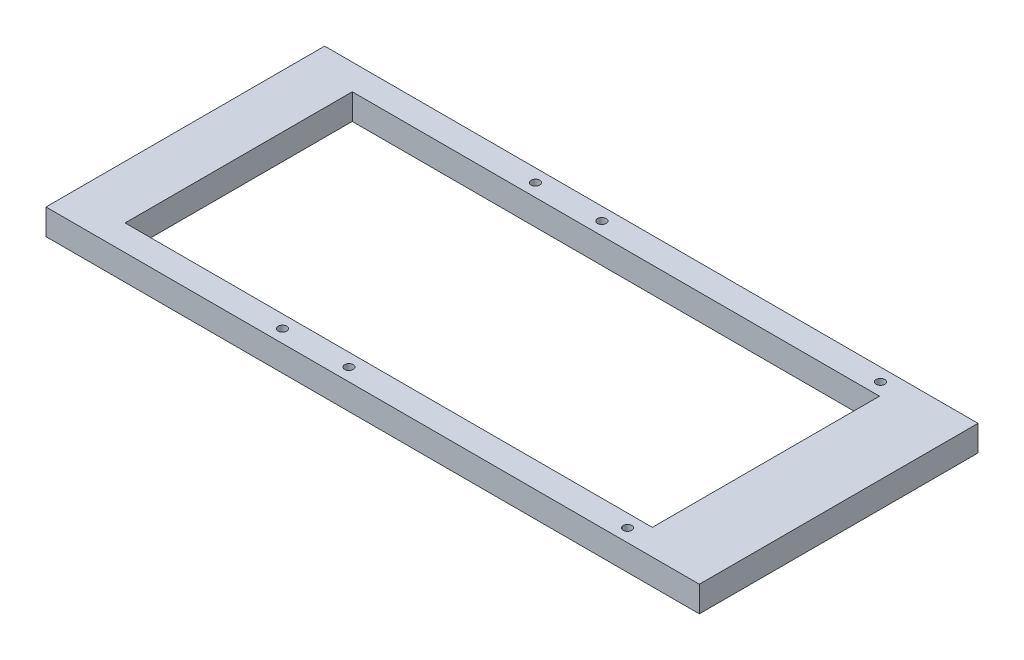
from build123d import *

# Parameters (mm, degrees)
SKETCH1_W                 = 246
SKETCH1_H                 = 106
BOSS_EXTRUDE1_DEPTH       = 12
SKETCH3_R                 = 2
CUT_EXTRUDE1_DEPTH        = 50.25
LPATTERN1_COUNT           = 2
LPATTERN1_PITCH           = 31
LPATTERN1_COPY_1_SKETCH_R = 2
LPATTERN1_COPY_1_DEPTH    = 50.25
LPATTERN2_COUNT           = 2
LPATTERN2_PITCH           = 161
MIRROR2_COPY_1_SKETCH_R   = 2
MIRROR2_COPY_1_DEPTH      = 50.25
MIRROR2_COPY_2_SKETCH_R   = 2
MIRROR2_COPY_2_DEPTH      = 50.25


with BuildPart() as part:
    # Sketch1 → Boss-Extrude1 (new body)
    with BuildSketch(Plane(origin=(0, 0, 0), x_dir=(1, 0, 0), z_dir=(0, 1, 0))):
        Polygon((-135, 65), (135, 65), (135, -65), (-135, -65), (-169.840376894, -65), (-169.840376894, 65), align=None)
        with Locations((-21.947414212, 0)):
            Rectangle(SKETCH1_W, SKETCH1_H, mode=Mode.SUBTRACT)
    extrude(amount=BOSS_EXTRUDE1_DEPTH)

    # Sketch3 → Cut-Extrude1 (cut)
    with BuildSketch(Plane(origin=(0, 12, 0), x_dir=(1, 0, 0), z_dir=(0, 1, 0))):
        with Locations(Location((-65.5, -59, 0), (0, 0, 270))):
            Circle(SKETCH3_R)
    cut_extrude1 = extrude(amount=-CUT_EXTRUDE1_DEPTH, mode=Mode.SUBTRACT)

    # Mirror1: Cut-Extrude1 across plane
    add(cut_extrude1.mirror(Plane.XY), mode=Mode.SUBTRACT)

    # LPattern1: Cut-Extrude1 ×2
    with Locations(*[(i * LPATTERN1_PITCH, 0, 0) for i in range(1, LPATTERN1_COUNT)]):
        add(cut_extrude1, mode=Mode.SUBTRACT)

    # LPattern1 copy 1 sketch → LPattern1 copy 1 (cut)
    with BuildSketch(Plane(origin=(31, 12, 0), x_dir=(1, 0, 0), z_dir=(0, 1, 0))):
        with Locations((-65.5, 59)):
            Circle(LPATTERN1_COPY_1_SKETCH_R)
    extrude(amount=-LPATTERN1_COPY_1_DEPTH, mode=Mode.SUBTRACT)

    # LPattern2: Cut-Extrude1 ×2
    with Locations(*[(i * LPATTERN2_PITCH, 0, 0) for i in range(1, LPATTERN2_COUNT)]):
        add(cut_extrude1, mode=Mode.SUBTRACT)

    # Mirror2 copy 1 sketch → Mirror2 copy 1 (cut)
    with BuildSketch(Plane(origin=(161, 12, 0), x_dir=(1, 0, 0), z_dir=(0, 1, 0))):
        with Locations((-65.5, 59)):
            Circle(MIRROR2_COPY_1_SKETCH_R)
    extrude(amount=-MIRROR2_COPY_1_DEPTH, mode=Mode.SUBTRACT)

    # Mirror2 copy 2 sketch → Mirror2 copy 2 (cut)
    with BuildSketch(Plane(origin=(0, 12, 0), x_dir=(1, 0, 0), z_dir=(0, 1, 0))):
        with Locations((-65.5, 59)):
            Circle(MIRROR2_COPY_2_SKETCH_R)
    extrude(amount=-MIRROR2_COPY_2_DEPTH, mode=Mode.SUBTRACT)


solid = part.part
